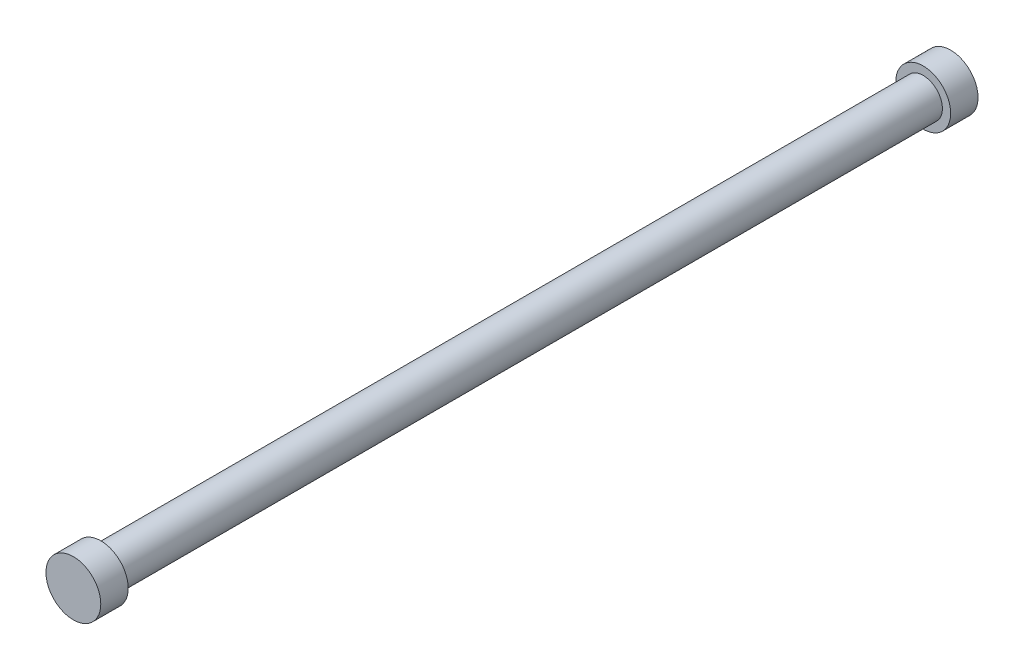
from build123d import *

# Parameters (mm, degrees)
SKETCH1_R           = 7
BOSS_EXTRUDE1_DEPTH = 320
SKETCH2_R           = 10
BOSS_EXTRUDE2_DEPTH = 10
BOSS_EXTRUDE3_START = -10
SKETCH3_R           = 10
BOSS_EXTRUDE3_DEPTH = 10


with BuildPart() as part:
    # Sketch1 → Boss-Extrude1 (new body)
    with BuildSketch(Plane.XY):
        Circle(SKETCH1_R)
    extrude(amount=BOSS_EXTRUDE1_DEPTH)

    # Sketch2 → Boss-Extrude2 (add)
    with BuildSketch(Plane.XY.offset(320)):
        Circle(SKETCH2_R)
    extrude(amount=-BOSS_EXTRUDE2_DEPTH)

    # Sketch3 → Boss-Extrude3 (add)
    with BuildSketch(Plane(origin=(0, 0, 0), x_dir=(-1, 0, 0), z_dir=(0, 0, -1)).offset(BOSS_EXTRUDE3_START)):
        with Locations(Location((0, 0, 0), (0, 0, 180))):
            Circle(SKETCH3_R)
    extrude(amount=BOSS_EXTRUDE3_DEPTH)


solid = part.part
